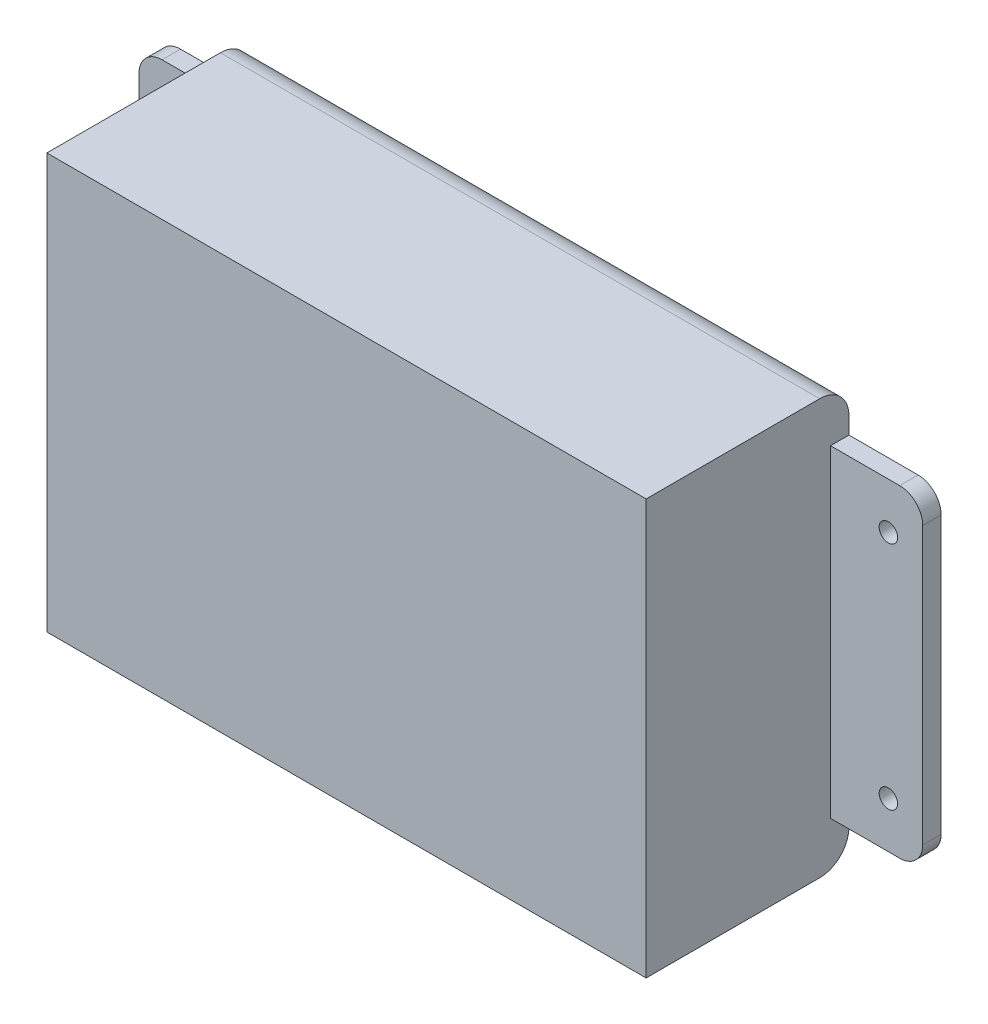
from build123d import *

# Parameters (mm, degrees)
SKETCH1_W           = 170
SKETCH1_H           = 90
BOSS_EXTRUDE1_DEPTH = 44
FILLET1_R           = 6.35
SKETCH3_W           = 20
SKETCH3_H           = 90
CUT_EXTRUDE7_DEPTH  = 40
SKETCH5_W           = 20
SKETCH5_H           = 10
SKETCH5_W_2         = 21.101892403
CUT_EXTRUDE8_DEPTH  = 36
SKETCH6_R           = 2
CUT_EXTRUDE9_DEPTH  = 36
FILLET3_R           = 5
CUT_EXTRUDE10_DEPTH = 10


with BuildPart() as part:
    # Sketch1 → Boss-Extrude1 (new body)
    with BuildSketch(Plane.XY):
        with Locations((85, -45)):
            Rectangle(SKETCH1_W, SKETCH1_H)
    extrude(amount=BOSS_EXTRUDE1_DEPTH)

    # Fillet1
    fillet1_edges = [part.edges().sort_by_distance(p)[0] for p in [
        (85, 0, 0),
        (85, -90, 0),
    ]]
    fillet(fillet1_edges, radius=FILLET1_R)

    # Sketch3 → Cut-Extrude7 (cut)
    with BuildSketch(Plane.XY.offset(44)):
        with Locations((160, -45)):
            Rectangle(SKETCH3_W, SKETCH3_H)
        with Locations((10, -45)):
            Rectangle(SKETCH3_W, SKETCH3_H)
    extrude(amount=-CUT_EXTRUDE7_DEPTH, mode=Mode.SUBTRACT)

    # Sketch5 → Cut-Extrude8 (cut)
    with BuildSketch(Plane.XY.offset(4)):
        with Locations((10, -5)):
            Rectangle(SKETCH5_W, SKETCH5_H)
        with Locations((10, -85)):
            Rectangle(SKETCH5_W, SKETCH5_H)
        with Locations((160, -5)):
            Rectangle(SKETCH5_W, SKETCH5_H)
        with Locations((160.550946202, -85)):
            Rectangle(SKETCH5_W_2, SKETCH5_H)
    extrude(amount=-CUT_EXTRUDE8_DEPTH, mode=Mode.SUBTRACT)

    # Sketch6 → Cut-Extrude9 (cut)
    with BuildSketch(Plane(origin=(0, 0, 0), x_dir=(-1, 0, 0), z_dir=(0, 0, -1))):
        with Locations((-162.552288005, -20)):
            Circle(SKETCH6_R)
        with Locations((-162.552288005, -70)):
            Circle(SKETCH6_R)
        with Locations((-10.503526876, -20)):
            Circle(SKETCH6_R)
        with Locations((-10.503526876, -70)):
            Circle(SKETCH6_R)
    extrude(amount=-CUT_EXTRUDE9_DEPTH, mode=Mode.SUBTRACT)

    # Fillet3
    fillet3_edges = [part.edges().sort_by_distance(p)[0] for p in [
        (170, -10, 2),
        (170, -80, 2),
        (0, -10, 2),
        (0, -80, 2),
    ]]
    fillet(fillet3_edges, radius=FILLET3_R)

    # Sketch7 → Cut-Extrude10 (cut)
    with BuildSketch(Plane(origin=(0, 0, 0), x_dir=(-1, 0, 0), z_dir=(0, 0, -1))):
        with BuildLine():
            Line((-96.51448024, -37.104485471), (-94.368564713, -37.104485471))
            add(Edge.make_bspline(
                [(-94.368564713, -37.104485471), (-94.030339848, -37.10373553), (-93.344172793, -37.102214101), (-92.301225612, -37.097402664), (-91.23001935, -37.086812056), (-90.506795242, -37.075683844), (-90.140316341, -37.070044852)],
                knots=[0, 0, 0, 0, 0.95986119, 1.947299551, 2.95983638, 4, 4, 4, 4], degree=3))
            Line((-90.140316341, -37.070044852), (-90.084681494, -37.141575369))
            Line((-90.084681494, -37.141575369), (-90.603940066, -39.986900402))
            Line((-90.603940066, -39.986900402), (-90.961592654, -40.047833806))
            Line((-90.961592654, -40.047833806), (-91.515291845, -37.782700749))
            Line((-91.515291845, -37.782700749), (-95.648166194, -37.782700749))
            Line((-95.648166194, -37.782700749), (-95.648166194, -42.869315332))
            Line((-95.648166194, -42.869315332), (-94.834837716, -42.869315332))
            add(Edge.make_bspline(
                [(-94.834837716, -42.869315332), (-94.674994905, -42.869839396), (-94.347352, -42.870913613), (-93.842260459, -42.862385291), (-93.310588027, -42.862978347), (-92.946779952, -42.856657126), (-92.760452707, -42.853419662)],
                knots=[0, 0, 0, 0, 0.924608237, 1.895245239, 2.922032839, 4, 4, 4, 4], degree=3))
            add(Edge.make_bspline(
                [(-92.760452707, -42.853419662), (-92.724584352, -42.850394303), (-92.65619372, -42.844625813), (-92.565113834, -42.80005388), (-92.493159218, -42.729975367), (-92.468634828, -42.668426383), (-92.455785687, -42.636178831)],
                knots=[0, 0, 0, 0, 1.068716211, 2.037734312, 2.971903963, 4, 4, 4, 4], degree=3))
            Line((-92.455785687, -42.636178831), (-92.143170833, -41.512884777))
            Line((-92.143170833, -41.512884777), (-91.65835288, -41.494339828))
            add(Edge.make_bspline(
                [(-91.65835288, -41.494339828), (-91.663121253, -41.687730244), (-91.671982478, -42.047114055), (-91.67919509, -42.545212804), (-91.685025691, -42.962029091), (-91.686731953, -43.212837188), (-91.687494943, -43.324991222)],
                knots=[0, 0, 0, 0, 1.267879065, 2.356141637, 3.264914697, 4, 4, 4, 4], degree=3))
            add(Edge.make_bspline(
                [(-91.687494943, -43.324991222), (-91.686727762, -43.434495955), (-91.685001556, -43.680888548), (-91.679190202, -44.091523259), (-91.671973438, -44.584323677), (-91.663120269, -44.94017493), (-91.65835288, -45.131799111)],
                knots=[0, 0, 0, 0, 0.727191112, 1.636226109, 2.727119176, 4, 4, 4, 4], degree=3))
            Line((-91.65835288, -45.131799111), (-92.143170833, -45.16623973))
            Line((-92.143170833, -45.16623973), (-92.463733523, -43.831003402))
            add(Edge.make_bspline(
                [(-92.463733523, -43.831003402), (-92.476865639, -43.793047736), (-92.501185263, -43.722756889), (-92.562894944, -43.63601172), (-92.646022045, -43.57964521), (-92.709294889, -43.5706909), (-92.741907758, -43.566075559)],
                knots=[0, 0, 0, 0, 1.165841965, 2.159045699, 3.051112636, 4, 4, 4, 4], degree=3))
            add(Edge.make_bspline(
                [(-92.741907758, -43.566075559), (-92.93088674, -43.563161963), (-93.300004869, -43.55747106), (-93.839597881, -43.553574535), (-94.350886246, -43.546152679), (-94.682060223, -43.547080379), (-94.842785552, -43.54753061)],
                knots=[0, 0, 0, 0, 1.079495133, 2.108494915, 3.082014899, 4, 4, 4, 4], degree=3))
            Line((-94.842785552, -43.54753061), (-95.648166194, -43.54753061))
            Line((-95.648166194, -43.54753061), (-95.648166194, -47.041928858))
            add(Edge.make_bspline(
                [(-95.648166194, -47.041928858), (-95.647080502, -47.394288912), (-95.644922649, -48.094617126), (-95.634700344, -48.794873959), (-95.629621245, -49.142806652)],
                knots=[0, 0, 0, 0, 1.006271195, 2, 2, 2, 2], degree=3))
            Line((-95.629621245, -49.142806652), (-91.33779019, -49.142806652))
            Line((-91.33779019, -49.142806652), (-90.246287478, -46.663082042))
            Line((-90.246287478, -46.663082042), (-89.843597157, -46.591551525))
            Line((-89.843597157, -46.591551525), (-90.042293039, -49.783932032))
            Line((-90.042293039, -49.783932032), (-90.103226443, -49.847514714))
            add(Edge.make_bspline(
                [(-90.103226443, -49.847514714), (-90.482074908, -49.844228456), (-91.223877511, -49.837793813), (-92.314461347, -49.824171655), (-93.360076045, -49.824249289), (-94.042704523, -49.822081827), (-94.376512548, -49.82102193)],
                knots=[0, 0, 0, 0, 1.063875567, 2.083116964, 3.062636615, 4, 4, 4, 4], degree=3))
            Line((-94.376512548, -49.82102193), (-96.477390342, -49.82102193))
            add(Edge.make_bspline(
                [(-96.477390342, -49.82102193), (-96.835926023, -49.82102193), (-97.566243777, -49.82102193), (-98.29656153, -49.82102193), (-98.668343603, -49.82102193)],
                knots=[0, 0, 0, 0, 0.981862152, 2, 2, 2, 2], degree=3))
            Line((-98.668343603, -49.82102193), (-98.702784223, -49.481914291))
            Line((-98.702784223, -49.481914291), (-97.603333675, -49.142806652))
            add(Edge.make_bspline(
                [(-97.603333675, -49.142806652), (-97.569706673, -49.130533807), (-97.505852756, -49.107229046), (-97.427828145, -49.044009578), (-97.375770808, -48.958845077), (-97.366910422, -48.893637097), (-97.362249338, -48.85933386)],
                knots=[0, 0, 0, 0, 1.072356029, 2.036284212, 2.966969876, 4, 4, 4, 4], degree=3))
            add(Edge.make_bspline(
                [(-97.362249338, -48.85933386), (-97.359319931, -48.730406727), (-97.353140527, -48.458442751), (-97.349274787, -48.027457832), (-97.342081351, -47.55060978), (-97.34314648, -47.216784552), (-97.343704389, -47.041928858)],
                knots=[0, 0, 0, 0, 0.851424291, 1.796027954, 2.845572385, 4, 4, 4, 4], degree=3))
            Line((-97.343704389, -47.041928858), (-97.343704389, -39.629247814))
            add(Edge.make_bspline(
                [(-97.343704389, -39.629247814), (-97.343136256, -39.481767252), (-97.342057781, -39.201807345), (-97.349277496, -38.802676167), (-97.353119016, -38.444097059), (-97.359318709, -38.218060158), (-97.362249338, -38.111211274)],
                knots=[0, 0, 0, 0, 1.165661162, 2.212755269, 3.155159611, 4, 4, 4, 4], degree=3))
            add(Edge.make_bspline(
                [(-97.362249338, -38.111211274), (-97.365106246, -38.074388142), (-97.370491709, -38.004974083), (-97.416412492, -37.913110899), (-97.484184734, -37.839219739), (-97.545419942, -37.814123206), (-97.57684089, -37.801245698)],
                knots=[0, 0, 0, 0, 1.089053236, 2.052937975, 3.000925474, 4, 4, 4, 4], degree=3))
            Line((-97.57684089, -37.801245698), (-98.684239274, -37.44359311))
            Line((-98.684239274, -37.44359311), (-98.702784223, -37.104485471))
            add(Edge.make_bspline(
                [(-98.702784223, -37.104485471), (-98.328352871, -37.104485471), (-97.598918211, -37.104485471), (-96.86948355, -37.104485471), (-96.51448024, -37.104485471)],
                knots=[0, 0, 0, 0, 1.026634383, 2, 2, 2, 2], degree=3))
        make_face()
        with BuildLine():
            add(Edge.make_bspline(
                [(-81.673222482, -37.917813949), (-81.82539073, -37.871337241), (-82.121915734, -37.780769688), (-82.564150573, -37.687327752), (-82.987193257, -37.623876658), (-83.263459898, -37.61665923), (-83.397902739, -37.61314693)],
                knots=[0, 0, 0, 0, 1.085488502, 2.115253907, 3.082804142, 4, 4, 4, 4], degree=3))
            add(Edge.make_bspline(
                [(-83.397902739, -37.61314693), (-83.494235526, -37.614319536), (-83.681991773, -37.616604991), (-83.955339608, -37.644560759), (-84.214294032, -37.68555595), (-84.457590102, -37.747140801), (-84.687204272, -37.822702242), (-84.899913874, -37.919867566), (-85.100161087, -38.029911773), (-85.28182092, -38.160392668), (-85.448110053, -38.302938581), (-85.59080048, -38.461901179), (-85.712094122, -38.634743988), (-85.812535602, -38.819223331), (-85.891365947, -39.018274297), (-85.941644787, -39.231748858), (-85.978903163, -39.457522926), (-85.982009267, -39.61318628), (-85.983598486, -39.692830496)],
                knots=[0, 0, 0, 0, 1.234208642, 2.405519354, 3.51827187, 4.591643104, 5.618907388, 6.611863802, 7.584813727, 8.542701907, 9.473318954, 10.386986489, 11.272527839, 12.174055887, 13.073663442, 14.007029733, 14.980308792, 16, 16, 16, 16], degree=3))
            add(Edge.make_bspline(
                [(-85.983598486, -39.692830496), (-85.980548707, -39.78927318), (-85.974637569, -39.976200232), (-85.928710005, -40.247806018), (-85.852451406, -40.501218802), (-85.742762696, -40.735790419), (-85.604097309, -40.951370978), (-85.449229634, -41.156204974), (-85.268796623, -41.345001783), (-85.001534798, -41.583783838), (-84.618541614, -41.849281459), (-84.114419888, -42.128522171), (-83.574307084, -42.38533369), (-83.205605717, -42.553660648), (-83.019055924, -42.638828109)],
                knots=[0, 0, 0, 0, 0.778259039, 1.508436541, 2.216563713, 2.908683688, 3.591078706, 4.282647702, 4.978612309, 5.695584281, 7.173255772, 8.727829764, 10.344398109, 12, 12, 12, 12], degree=3))
            add(Edge.make_bspline(
                [(-83.019055924, -42.638828109), (-82.813476111, -42.730947543), (-82.405685634, -42.91367671), (-81.812539566, -43.211063628), (-81.249487206, -43.534904246), (-80.826893149, -43.858684767), (-80.522134928, -44.144621331), (-80.320092976, -44.382129984), (-80.141891547, -44.640520259), (-79.987573223, -44.919238101), (-79.860452008, -45.220048834), (-79.774803823, -45.546558024), (-79.720452278, -45.895621732), (-79.71361949, -46.136546739), (-79.710107166, -46.260391721)],
                knots=[0, 0, 0, 0, 1.543398054, 3.0615021, 4.545469272, 5.98688264, 6.697343335, 7.405507011, 8.118847824, 8.844680014, 9.585218838, 10.349959468, 11.151813912, 12, 12, 12, 12], degree=3))
            add(Edge.make_bspline(
                [(-79.710107166, -46.260391721), (-79.713436567, -46.407299844), (-79.719934285, -46.694008292), (-79.792148934, -47.109728808), (-79.901920177, -47.500079234), (-80.059389183, -47.863866018), (-80.263079961, -48.19944511), (-80.507809751, -48.511127778), (-80.804062696, -48.788915622), (-81.13719187, -49.042525611), (-81.50540607, -49.266645638), (-81.90177636, -49.459568341), (-82.321813306, -49.623897759), (-82.765286979, -49.759630727), (-83.233352565, -49.861840252), (-83.725400848, -49.935642068), (-84.242163232, -49.981318168), (-84.595281666, -49.98744723), (-84.775527522, -49.990575749)],
                knots=[0, 0, 0, 0, 0.995693307, 1.943212381, 2.853401529, 3.741575323, 4.623157416, 5.510178669, 6.421254701, 7.370287868, 8.346430534, 9.34050028, 10.357381684, 11.403528079, 12.483557003, 13.604551818, 14.777266867, 16, 16, 16, 16], degree=3))
            add(Edge.make_bspline(
                [(-84.775527522, -49.990575749), (-85.019545759, -49.984009303), (-85.520699893, -49.970523421), (-86.290512924, -49.870746151), (-87.098107183, -49.719622303), (-87.642919287, -49.573100173), (-87.922870296, -49.497809961)],
                knots=[0, 0, 0, 0, 0.916293707, 1.881844505, 2.911588482, 4, 4, 4, 4], degree=3))
            Line((-87.922870296, -49.497809961), (-87.975855864, -49.426279444))
            Line((-87.975855864, -49.426279444), (-87.538724923, -46.323974404))
            Line((-87.538724923, -46.323974404), (-87.136034602, -46.260391721))
            Line((-87.136034602, -46.260391721), (-86.510804893, -48.771907672))
            add(Edge.make_bspline(
                [(-86.510804893, -48.771907672), (-86.352780765, -48.828785174), (-86.039070667, -48.941698606), (-85.553542595, -49.057332665), (-85.062885097, -49.128316282), (-84.733374097, -49.137981715), (-84.568883805, -49.142806652)],
                knots=[0, 0, 0, 0, 1.013176663, 2.01136215, 3.007281639, 4, 4, 4, 4], degree=3))
            add(Edge.make_bspline(
                [(-84.568883805, -49.142806652), (-84.461062466, -49.141852984), (-84.25029369, -49.139988757), (-83.944335025, -49.108923886), (-83.65544326, -49.065291653), (-83.386409696, -49.001530443), (-83.133716688, -48.922836741), (-82.901753459, -48.822114584), (-82.686972202, -48.704376129), (-82.490269192, -48.570203386), (-82.315828188, -48.416431448), (-82.162723009, -48.247716456), (-82.032026718, -48.064136899), (-81.924590533, -47.864354038), (-81.846480096, -47.64761917), (-81.788148325, -47.417882575), (-81.748964313, -47.173073479), (-81.746181148, -47.004112896), (-81.744753, -46.917412772)],
                knots=[0, 0, 0, 0, 1.270299755, 2.483177503, 3.621207158, 4.711934724, 5.739017396, 6.736776301, 7.687149045, 8.622641224, 9.537225582, 10.421574316, 11.302485812, 12.187263261, 13.086374941, 14.010388254, 14.979054274, 16, 16, 16, 16], degree=3))
            add(Edge.make_bspline(
                [(-81.744753, -46.917412772), (-81.747884638, -46.822750073), (-81.753980375, -46.638489033), (-81.799055627, -46.371043057), (-81.876833852, -46.122002266), (-81.983737385, -45.890166335), (-82.116321616, -45.675483299), (-82.272688223, -45.47900176), (-82.444486182, -45.29315618), (-82.712211087, -45.071257787), (-83.084306122, -44.812359929), (-83.580430412, -44.544192781), (-84.109921261, -44.287839962), (-84.472367369, -44.120117538), (-84.656309993, -44.034997841)],
                knots=[0, 0, 0, 0, 0.779269004, 1.516847907, 2.225209504, 2.92148785, 3.61365338, 4.297325759, 4.98662073, 5.693300865, 7.155751331, 8.71165789, 10.331155278, 12, 12, 12, 12], degree=3))
            add(Edge.make_bspline(
                [(-84.656309993, -44.034997841), (-84.864516317, -43.942023486), (-85.27899323, -43.756939176), (-85.883093808, -43.455014915), (-86.448949258, -43.109041382), (-86.884024879, -42.78003304), (-87.189985951, -42.477446561), (-87.399728877, -42.23093255), (-87.578094403, -41.955830852), (-87.73693869, -41.660475806), (-87.865329861, -41.338673924), (-87.954488211, -40.988795863), (-88.007597981, -40.613761556), (-88.014633405, -40.355327078), (-88.018244319, -40.222686182)],
                knots=[0, 0, 0, 0, 1.505590493, 2.997183208, 4.45523457, 5.880494019, 6.585539522, 7.293280273, 8.012930273, 8.745897636, 9.504910951, 10.294054083, 11.12442722, 12, 12, 12, 12], degree=3))
            add(Edge.make_bspline(
                [(-88.018244319, -40.222686182), (-88.014619495, -40.089030732), (-88.007514705, -39.827061131), (-87.938659832, -39.446464907), (-87.831554228, -39.087442678), (-87.675012102, -38.7548659), (-87.481117457, -38.442247362), (-87.236584439, -38.15852966), (-86.950160011, -37.897507018), (-86.624984006, -37.661035421), (-86.26895273, -37.451498159), (-85.890366787, -37.267925994), (-85.492866336, -37.111477851), (-85.076380992, -36.984635795), (-84.641435416, -36.88674816), (-84.187570547, -36.81520583), (-83.714004657, -36.772224019), (-83.391810447, -36.767682115), (-83.22834892, -36.765377832)],
                knots=[0, 0, 0, 0, 0.969870177, 1.900981247, 2.799786438, 3.683637421, 4.562727952, 5.463658981, 6.394306014, 7.371865646, 8.378371075, 9.390988941, 10.424835136, 11.477842863, 12.549919072, 13.660298415, 14.812979307, 16, 16, 16, 16], degree=3))
            add(Edge.make_bspline(
                [(-83.22834892, -36.765377832), (-82.989762407, -36.769464578), (-82.506474511, -36.777742811), (-81.774569186, -36.846058678), (-81.024763135, -36.945963359), (-80.523785898, -37.049302064), (-80.269104915, -37.101836193)],
                knots=[0, 0, 0, 0, 0.959381208, 1.943350944, 2.954464664, 4, 4, 4, 4], degree=3))
            Line((-80.269104915, -37.101836193), (-80.205522233, -37.168068154))
            Line((-80.205522233, -37.168068154), (-80.735377918, -40.013393186))
            Line((-80.735377918, -40.013393186), (-81.093030506, -40.076975868))
            Line((-81.093030506, -40.076975868), (-81.673222482, -37.917813949))
        make_face()
        with BuildLine():
            Line((-68.940790353, -40.135259994), (-69.298442941, -40.190894841))
            Line((-69.298442941, -40.190894841), (-69.952814713, -37.886022608))
            add(Edge.make_bspline(
                [(-69.952814713, -37.886022608), (-70.13252824, -37.844063966), (-70.482237642, -37.762415512), (-70.999267165, -37.680147016), (-71.489822837, -37.621688495), (-71.808917726, -37.61593585), (-71.96361704, -37.61314693)],
                knots=[0, 0, 0, 0, 1.088477901, 2.118098511, 3.087641701, 4, 4, 4, 4], degree=3))
            add(Edge.make_bspline(
                [(-71.96361704, -37.61314693), (-72.141420904, -37.617160047), (-72.488943281, -37.625003791), (-72.994482959, -37.70278725), (-73.472504871, -37.819591254), (-73.921198489, -37.990106831), (-74.338628209, -38.212266654), (-74.729784716, -38.478397061), (-75.088698045, -38.796607591), (-75.415141355, -39.15981351), (-75.710596336, -39.558626993), (-75.959816651, -39.994274121), (-76.180845707, -40.452790995), (-76.353305147, -40.944108458), (-76.493579591, -41.461643522), (-76.584358255, -42.009414978), (-76.650048642, -42.584255408), (-76.655398233, -42.977732805), (-76.658138416, -43.179280909)],
                knots=[0, 0, 0, 0, 1.039745367, 2.032209956, 2.986008345, 3.915042519, 4.832768629, 5.747259039, 6.67724131, 7.632145001, 8.600613798, 9.575568441, 10.564920306, 11.575093636, 12.61800617, 13.698682609, 14.821212704, 16, 16, 16, 16], degree=3))
            add(Edge.make_bspline(
                [(-76.658138416, -43.179280909), (-76.65477236, -43.394085981), (-76.648188012, -43.81426656), (-76.576253467, -44.426995373), (-76.467444168, -45.007167391), (-76.310284284, -45.553477463), (-76.109705322, -46.06712506), (-75.860902136, -46.546155963), (-75.57240595, -46.995205281), (-75.235412764, -47.403917794), (-74.86185584, -47.774924723), (-74.449512642, -48.095815688), (-74.003334203, -48.36967934), (-73.520920223, -48.588373765), (-73.006101617, -48.761567895), (-72.456835362, -48.885734562), (-71.872986523, -48.960863542), (-71.471962498, -48.969060472), (-71.266856814, -48.973252832)],
                knots=[0, 0, 0, 0, 1.150941887, 2.251359443, 3.302310505, 4.312135758, 5.294047232, 6.253145676, 7.201151829, 8.149736938, 9.087009725, 10.0178529, 10.944195404, 11.886808548, 12.85085921, 13.851085601, 14.900927299, 16, 16, 16, 16], degree=3))
            add(Edge.make_bspline(
                [(-71.266856814, -48.973252832), (-71.026339214, -48.966988502), (-70.537310676, -48.954251653), (-69.79526766, -48.852571638), (-69.033749539, -48.696476088), (-68.528200204, -48.542879294), (-68.270522911, -48.464591374)],
                knots=[0, 0, 0, 0, 0.945703394, 1.922836208, 2.941274556, 4, 4, 4, 4], degree=3))
            Line((-68.270522911, -48.464591374), (-68.172499609, -48.843438189))
            add(Edge.make_bspline(
                [(-68.172499609, -48.843438189), (-68.320462144, -48.934873439), (-68.614964189, -49.116864562), (-69.078800727, -49.349496618), (-69.556230173, -49.549597677), (-70.049850636, -49.711077107), (-70.557588735, -49.835101245), (-71.078738989, -49.925974297), (-71.614558732, -49.979381289), (-71.976746008, -49.98681929), (-72.159663644, -49.990575749)],
                knots=[0, 0, 0, 0, 0.991626125, 1.973715307, 2.955869065, 3.941786668, 4.932491397, 5.934424837, 6.956810052, 8, 8, 8, 8], degree=3))
            add(Edge.make_bspline(
                [(-72.159663644, -49.990575749), (-72.394794612, -49.984706355), (-72.855921998, -49.973195586), (-73.531107131, -49.890918431), (-74.172561452, -49.750867949), (-74.779792068, -49.553253347), (-75.356456553, -49.304496227), (-75.898632427, -48.995405199), (-76.407406311, -48.630480891), (-76.877200684, -48.212477034), (-77.303728551, -47.750258378), (-77.676560266, -47.247892709), (-77.990302182, -46.708811921), (-78.249768962, -46.135937866), (-78.447267035, -45.52584781), (-78.590479192, -44.882051112), (-78.676315283, -44.202452211), (-78.687210227, -43.7376458), (-78.69278425, -43.499843598)],
                knots=[0, 0, 0, 0, 1.089467417, 2.136610357, 3.146408505, 4.127352908, 5.091352325, 6.051696722, 7.013591848, 7.987580447, 8.960691772, 9.92320475, 10.880545116, 11.845777148, 12.831880732, 13.846559358, 14.898266216, 16, 16, 16, 16], degree=3))
            add(Edge.make_bspline(
                [(-78.69278425, -43.499843598), (-78.686775607, -43.246986214), (-78.675052038, -42.753631634), (-78.580873614, -42.033986574), (-78.425709639, -41.354548831), (-78.205156709, -40.716000051), (-77.923271336, -40.117157418), (-77.576090076, -39.560791139), (-77.168305582, -39.042824806), (-76.698883956, -38.570594916), (-76.181777849, -38.14619472), (-75.625154346, -37.774487612), (-75.03026433, -37.46529339), (-74.402695023, -37.205639421), (-73.737586156, -37.007507797), (-73.036853233, -36.868455703), (-72.301361977, -36.781821936), (-71.798721773, -36.770931708), (-71.54238177, -36.765377832)],
                knots=[0, 0, 0, 0, 1.096505755, 2.139412049, 3.142010988, 4.114771106, 5.064040669, 6.006865809, 6.953294689, 7.917578308, 8.889191356, 9.850671021, 10.815319772, 11.792714759, 12.792521805, 13.820213443, 14.888337048, 16, 16, 16, 16], degree=3))
            add(Edge.make_bspline(
                [(-71.54238177, -36.765377832), (-71.288783062, -36.770240603), (-70.778033383, -36.780034258), (-70.008389123, -36.851620345), (-69.229868256, -36.967114569), (-68.712394773, -37.079457489), (-68.450673844, -37.136276812)],
                knots=[0, 0, 0, 0, 0.975186661, 1.964033165, 2.970275485, 4, 4, 4, 4], degree=3))
            Line((-68.450673844, -37.136276812), (-68.387091162, -37.210456608))
            Line((-68.387091162, -37.210456608), (-68.940790353, -40.135259994))
        make_face()
    extrude(amount=-CUT_EXTRUDE10_DEPTH, mode=Mode.SUBTRACT)


solid = part.part
